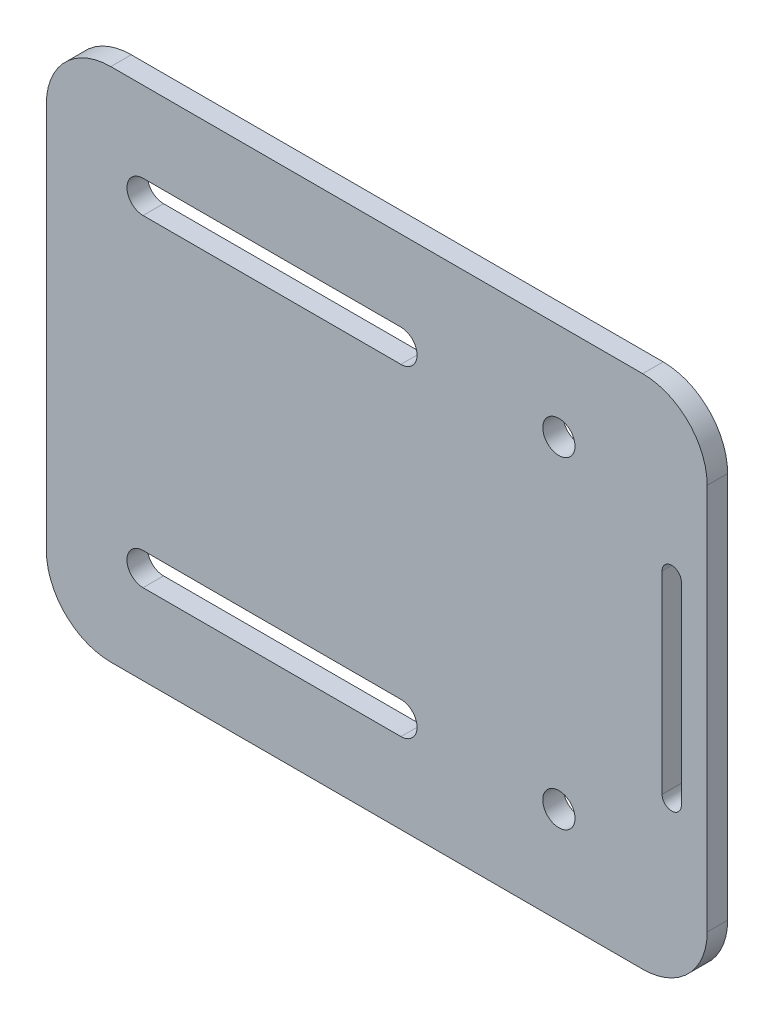
from build123d import *

# Parameters (mm, degrees)
SKETCH1_W           = 102.5
SKETCH1_H           = 80
SKETCH1_R           = 2.5
BOSS_EXTRUDE1_DEPTH = 3.175
FILLET1_R           = 10


with BuildPart() as part:
    # Sketch1 → Boss-Extrude1 (new body)
    with BuildSketch(Plane.XY):
        with Locations((-28.25, 0)):
            Rectangle(SKETCH1_W, SKETCH1_H)
        with Locations((0, 25)):
            Circle(SKETCH1_R, mode=Mode.SUBTRACT)
        with Locations(Location((0, -25, 0), (0, 0, 180))):
            Circle(SKETCH1_R, mode=Mode.SUBTRACT)
        with BuildLine():
            Line((-64.5, -27.5), (-24.5, -27.5))
            ThreePointArc((-24.5, -27.5), (-22, -25), (-24.5, -22.5))
            Line((-24.5, -22.5), (-64.5, -22.5))
            ThreePointArc((-64.5, -22.5), (-67, -25), (-64.5, -27.5))
        make_face(mode=Mode.SUBTRACT)
        with BuildLine():
            Line((-64.5, 27.5), (-24.5, 27.5))
            ThreePointArc((-24.5, 27.5), (-22, 25), (-24.5, 22.5))
            Line((-24.5, 22.5), (-64.5, 22.5))
            ThreePointArc((-64.5, 22.5), (-67, 25), (-64.5, 27.5))
        make_face(mode=Mode.SUBTRACT)
        with BuildLine():
            Line((19, 15), (19, -15))
            ThreePointArc((19, -15), (17.5, -16.5), (16, -15))
            Line((16, -15), (16, 15))
            ThreePointArc((16, 15), (17.5, 16.5), (19, 15))
        make_face(mode=Mode.SUBTRACT)
    extrude(amount=BOSS_EXTRUDE1_DEPTH)

    # Fillet1
    fillet1_edges = [part.edges().sort_by_distance(p)[0] for p in [
        (23, -40, 1.5875),
        (-79.5, -40, 1.5875),
        (-79.5, 40, 1.5875),
        (23, 40, 1.5875),
    ]]
    fillet(fillet1_edges, radius=FILLET1_R)


solid = part.part
